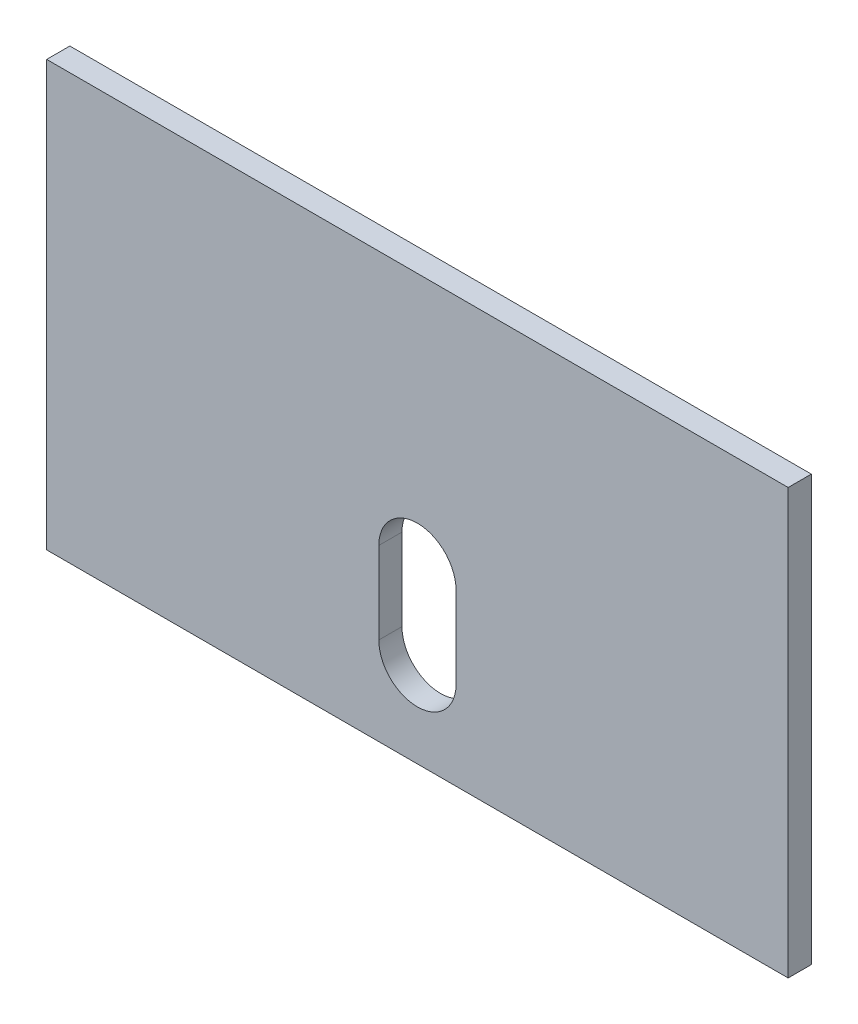
from build123d import *

# Parameters (mm, degrees)
SKETCH1_W           = 96
SKETCH1_H           = 55
BOSS_EXTRUDE1_DEPTH = 1.5


with BuildPart() as part:
    # Sketch1 → Boss-Extrude1 (new, symmetric)
    with BuildSketch(Plane.XY):
        Rectangle(SKETCH1_W, SKETCH1_H)
        with BuildLine():
            Line((-5, -16.1), (-5, -5.5))
            ThreePointArc((-5, -5.5), (0, -0.5), (5, -5.5))
            Line((5, -5.5), (5, -16.1))
            ThreePointArc((5, -16.1), (0, -21.1), (-5, -16.1))
        make_face(mode=Mode.SUBTRACT)
    extrude(amount=BOSS_EXTRUDE1_DEPTH, both=True)


solid = part.part
